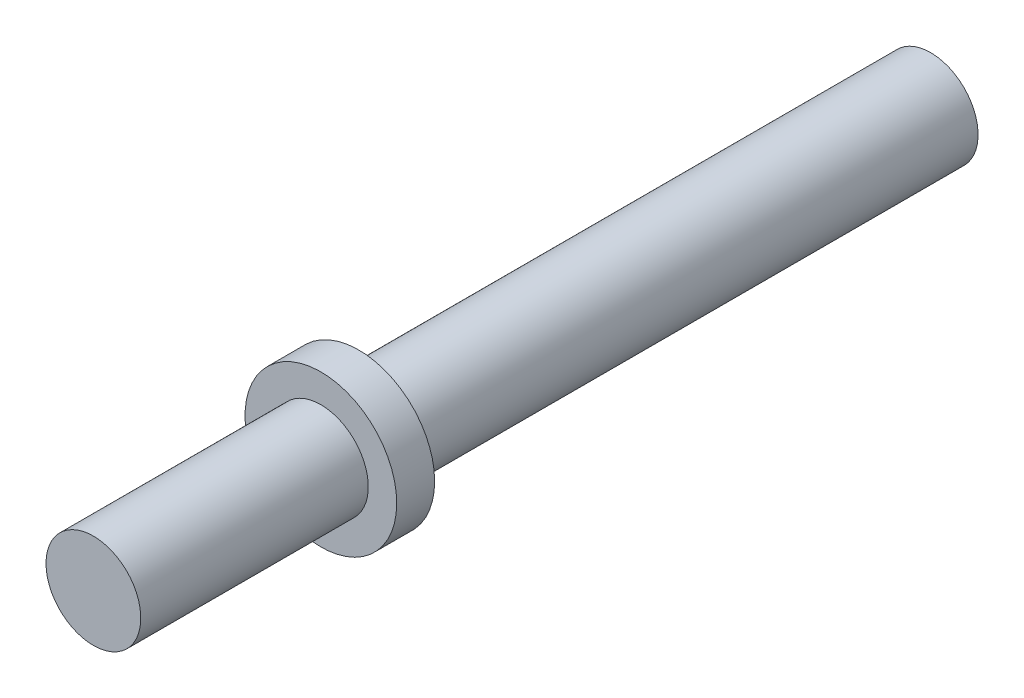
from build123d import *

# Parameters (mm, degrees)
PLUNGER_STEM_START     = 17.500063
SKETCH1_R              = 1.5
PLUNGER_STEM_DEPTH     = 26.499937
CAPTIVE_SHOULDER_START = 35.6
SKETCH2_R              = 2.4
CAPTIVE_SHOULDER_DEPTH = 1.2


with BuildPart() as part:
    # Sketch1 → Plunger_stem (new body)
    with BuildSketch(Plane.XY.offset(PLUNGER_STEM_START)):
        with Locations((-32.018684277, -34.643402341)):
            Circle(SKETCH1_R)
    extrude(amount=PLUNGER_STEM_DEPTH)

    # Sketch2 → Captive_shoulder (add)
    with BuildSketch(Plane.XY.offset(CAPTIVE_SHOULDER_START)):
        with Locations((-32.018684277, -34.643402341)):
            Circle(SKETCH2_R)
    extrude(amount=CAPTIVE_SHOULDER_DEPTH)


solid = part.part
